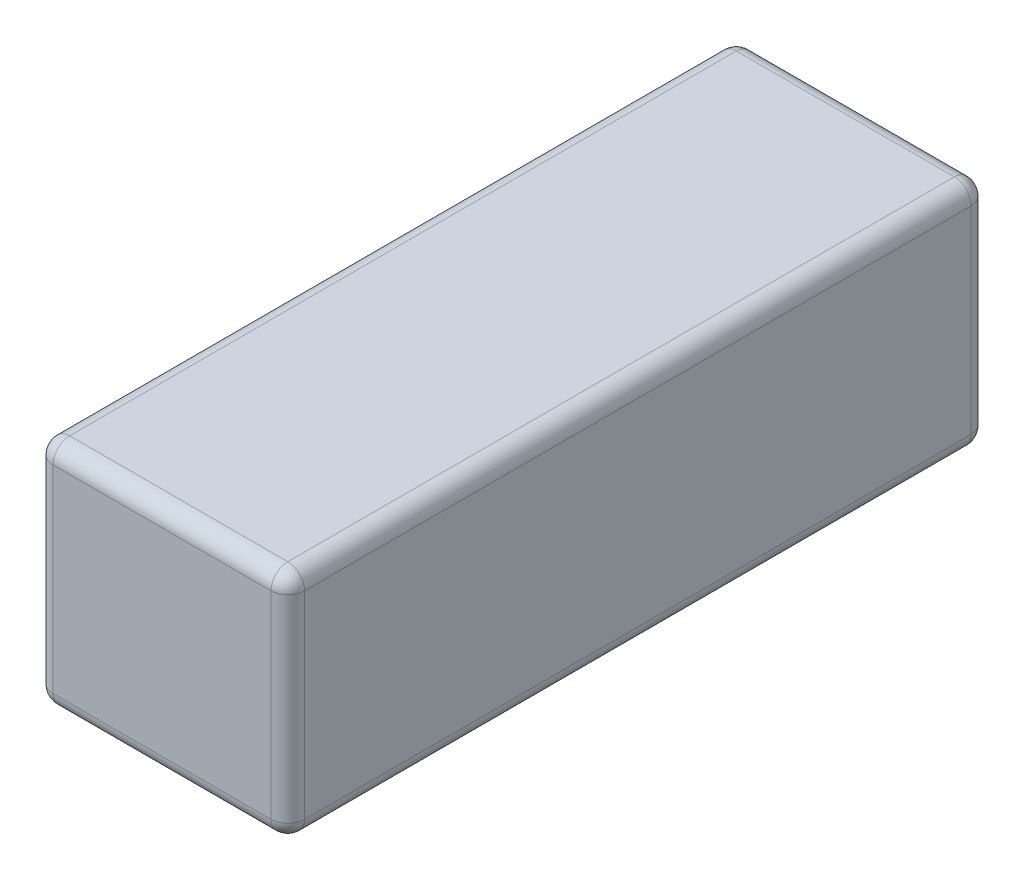
from build123d import *

# Parameters (mm, degrees)
SKETCH1_W           = 38.1
SKETCH1_H           = 106
BOSS_EXTRUDE1_DEPTH = 35.052
FILLET1_R           = 2.54


with BuildPart() as part:
    # Sketch1 → Boss-Extrude1 (new body)
    with BuildSketch(Plane(origin=(0, 0, 0), x_dir=(1, 0, 0), z_dir=(0, 1, 0))):
        with Locations((-9.57541945, -40.262373163)):
            Rectangle(SKETCH1_W, SKETCH1_H)
    extrude(amount=BOSS_EXTRUDE1_DEPTH)

    # Fillet1
    fillet1_edges = [part.edges().sort_by_distance(p)[0] for p in [
        (9.47458055, 35.052, 40.262373163),
        (-9.57541945, 35.052, -12.737626837),
        (-28.62541945, 35.052, 40.262373163),
        (-9.57541945, 0, -12.737626837),
        (9.47458055, 0, 40.262373163),
        (-9.57541945, 0, 93.262373163),
        (-28.62541945, 0, 40.262373163),
        (-28.62541945, 17.526, -12.737626837),
        (9.47458055, 17.526, -12.737626837),
        (9.47458055, 17.526, 93.262373163),
        (-28.62541945, 17.526, 93.262373163),
        (-9.57541945, 35.052, 93.262373163),
    ]]
    fillet(fillet1_edges, radius=FILLET1_R)


solid = part.part
